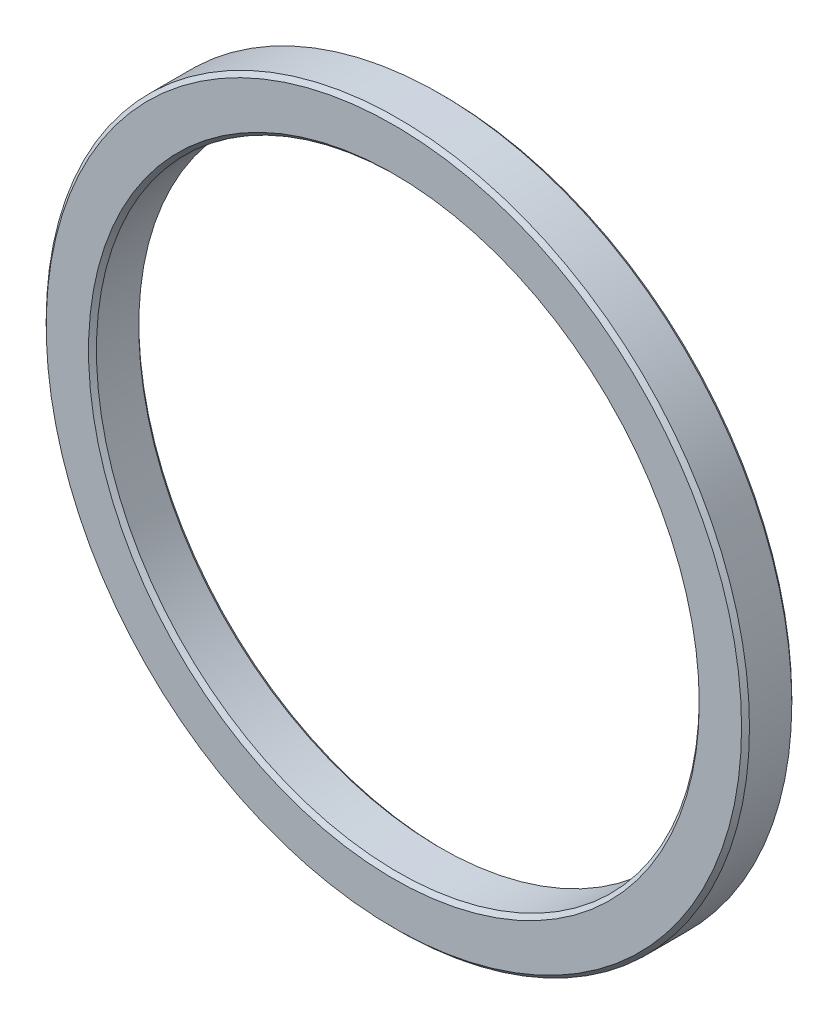
from build123d import *

# Parameters (mm, degrees)
SKETCH_1_R      = 44.45
SKETCH_1_R_2    = 38.1
EXTRUDE_1_DEPTH = 6.35
CHAMFER_1_SIZE  = 0.5


with BuildPart() as part:
    # 草图1 → 凸台-拉伸1 (new body)
    with BuildSketch(Plane.XY):
        Circle(SKETCH_1_R)
        Circle(SKETCH_1_R_2, mode=Mode.SUBTRACT)
    extrude(amount=EXTRUDE_1_DEPTH)

    # 倒角1
    chamfer_1_edges = [part.edges().sort_by_distance(p)[0] for p in [
        (-44.45, 0, 0),
        (-44.45, 0, 6.35),
        (-38.1, 0, 0),
        (-38.1, 0, 6.35),
    ]]
    chamfer(chamfer_1_edges, length=CHAMFER_1_SIZE)


solid = part.part
